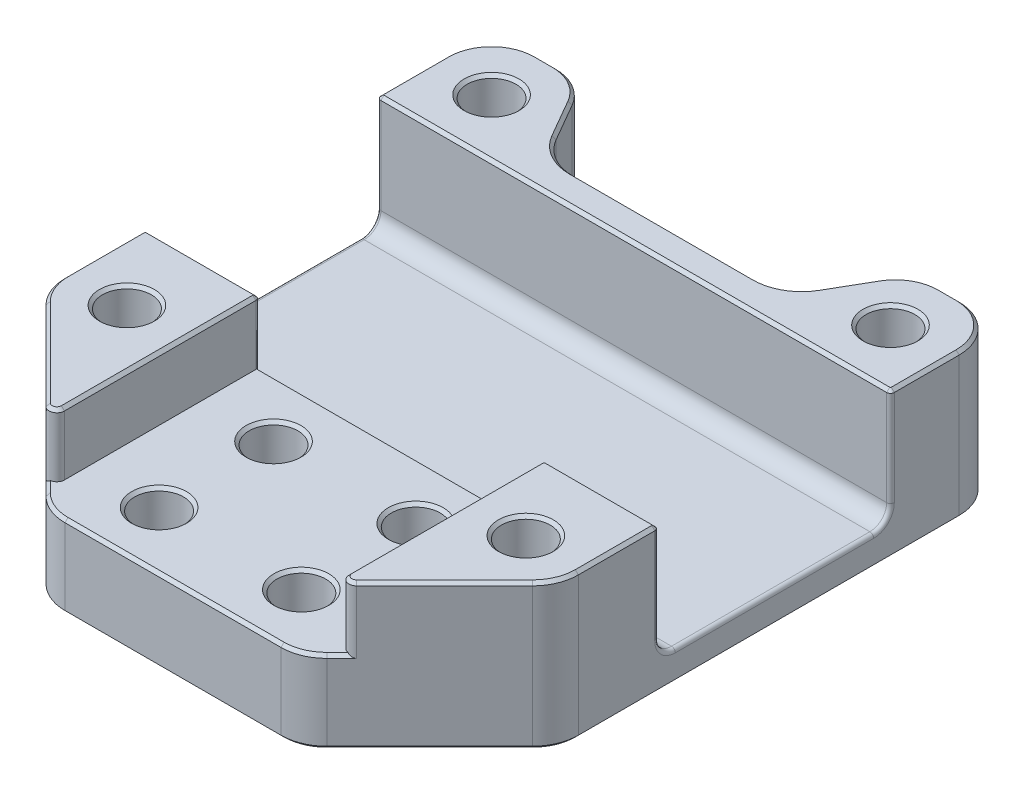
from build123d import *

# Parameters (mm, degrees)
SKETCH1_W           = 16.6624
SKETCH1_H           = 37.2872
BOSS_EXTRUDE1_DEPTH = 100
BOSS_EXTRUDE2_DEPTH = 18.6436
SKETCH2_3_W         = 8.2312
SKETCH2_3_H         = 29.9
SKETCH2_3_H_2       = 0.1
BOSS_EXTRUDE3_DEPTH = 15
SKETCH3_R           = 3.2
CUT_EXTRUDE1_DEPTH  = 151.542823877
FILLET1_R           = 6
FILLET3_R           = 2.2
FILLET2_R           = 0.5
FILLET4_R           = 1
CHAMFER1_SIZE       = 0.4


with BuildPart() as part:
    # Sketch1 → Boss-Extrude1 (new, symmetric)
    with BuildSketch(Plane(origin=(0, 0, 0), x_dir=(0, 1, 0), z_dir=(0, 0, 1))):
        Rectangle(SKETCH1_W, SKETCH1_H)
    extrude(amount=BOSS_EXTRUDE1_DEPTH, both=True)


with BuildPart() as body_2:
    # Sketch2 → Boss-Extrude2 (new body)
    with BuildSketch(Plane.YZ.offset(18.6436)):
        Polygon((-8.3312, -100), (-8.3312, -70.1), (-19.1, -70.1), (-19.1, -145.5), (-0.1, -145.5), (-0.1, -130.5), (-15.2, -130.5), (-15.2, -100.1), (-8.3312, -100.1), align=None)
    extrude(amount=-BOSS_EXTRUDE2_DEPTH)

    # Sketch2<3> → Boss-Extrude3 (add)
    with BuildSketch(Plane.YZ.offset(18.6436)):
        Polygon((-8.3312, -100), (-8.3312, -70.1), (-19.1, -70.1), (-19.1, -145.5), (-0.1, -145.5), (-0.1, -130.5), (-15.2, -130.5), (-15.2, -100.1), (-8.3312, -100.1), align=None)
        with Locations((-4.2156, -85.05)):
            Rectangle(SKETCH2_3_W, SKETCH2_3_H)
        with Locations((-4.2156, -100.05)):
            Rectangle(SKETCH2_3_W, SKETCH2_3_H_2)
    extrude(amount=BOSS_EXTRUDE3_DEPTH)

    # Sketch3 → Cut-Extrude1 (cut, through all)
    with BuildSketch(Plane.XZ.offset(19.1)):
        Polygon((15.46262002, -134.5), (0, -134.5), (0, -145.5), (21.813472981, -145.5), align=None)
        with Locations(Location((26.1436, -138, 0), (0, 0, 270))):
            Circle(SKETCH3_R)
        with Locations(Location((26.1436, -90.206601718, 0), (0, 0, 270))):
            Circle(SKETCH3_R)
        Polygon((33.6436, -70.1), (18.6436, -70.1), (18.6436, -72.1), (33.6436, -87.1), align=None)
        Polygon((18.6436, -70.1), (16.6436, -70.1), (18.6436, -72.1), align=None)
        with Locations(Location((9.3218, -77.6, 0), (0, 0, 270))):
            Circle(SKETCH3_R)
        with Locations(Location((9.3218, -92.6, 0), (0, 0, 270))):
            Circle(SKETCH3_R)
    extrude(amount=-CUT_EXTRUDE1_DEPTH, mode=Mode.SUBTRACT)

    # Fillet1
    fillet1_edges = [body_2.edges().sort_by_distance(p)[0] for p in [
        (15.46262002, -9.6, -134.5),
        (21.813472981, -9.6, -145.5),
        (33.6436, -9.6, -145.5),
        (16.6436, -13.7156, -70.1),
        (33.6436, -9.6, -87.1),
    ]]
    fillet(fillet1_edges, radius=FILLET1_R)

    # Fillet3
    fillet3_edges = [body_2.edges().sort_by_distance(p)[0] for p in [
        (16.8218, -15.2, -130.5),
        (16.8218, -15.2, -100.1),
    ]]
    fillet(fillet3_edges, radius=FILLET3_R)

    # Fillet2
    fillet2_edges = [body_2.edges().sort_by_distance(p)[0] for p in [
        (33.6436, -6.55, -130.5),
        (33.6436, -15.2, -115.3),
        (33.6436, -14.555634919, -129.855634919),
        (33.6436, -14.555634919, -100.744365081),
        (33.6436, -6.55, -100.1),
        (18.6436, -4.2156, -100.1),
    ]]
    fillet(fillet2_edges, radius=FILLET2_R)

    # Fillet4
    fillet4_edges = [body_2.edges().sort_by_distance(p)[0] for p in [
        (18.6436, -4.2156, -72.1),
    ]]
    fillet(fillet4_edges, radius=FILLET4_R)

    # Chamfer1
    chamfer1_edges = [body_2.edges().sort_by_distance(p)[0] for p in [
        (26.1436, -0.1, -87.006601718),
        (26.1436, -19.1, -87.006601718),
        (26.1436, -0.1, -134.8),
        (26.1436, -19.1, -134.8),
        (9.3218, -8.3312, -89.4),
        (9.3218, -19.1, -89.4),
        (5.999259202, -19.1, -134.5),
        (5.999259202, -0.1, -134.5),
        (26.460587298, -0.1, -145.5),
        (26.460587298, -19.1, -145.5),
        (33.6436, -19.1, -114.542640687),
        (25.1436, -19.1, -78.6),
        (18.638046501, -19.1, -140),
        (16.45441922, -19.1, -70.556722805),
        (33.186877195, -19.1, -87.28918078),
        (22.277574596, -19.1, -144.696152423),
        (31.886240687, -19.1, -143.742640687),
        (18.638046501, -0.1, -140),
        (22.277574596, -0.1, -144.696152423),
        (31.886240687, -0.1, -143.742640687),
        (19.375833047, -8.3312, -72.832233047),
        (33.186877195, -0.1, -87.28918078),
        (16.45441922, -8.3312, -70.556722805),
        (14.998518405, -19.1, -135.303847577),
        (14.998518405, -0.1, -135.303847577),
        (33.6436, -0.1, -135.25),
        (33.6436, -0.1, -94.592640687),
        (33.497153391, -0.1, -130.646446609),
        (18.6436, -0.1, -87.057106781),
        (26.1436, -0.1, -100.1),
        (33.497153391, -0.1, -99.953553391),
        (18.790046609, -0.1, -99.953553391),
        (26.118473734, -0.1, -79.574873734),
        (19.260916568, -0.1, -73.59033403),
        (7.079159313, -19.1, -70.1),
        (16.5718, -0.1, -130.5),
        (9.5718, -8.3312, -100.1),
        (7.079159313, -8.3312, -70.1),
        (9.3218, -8.3312, -74.4),
        (9.3218, -19.1, -74.4),
    ]]
    chamfer(chamfer1_edges, length=CHAMFER1_SIZE)

    # Mirror1: body 2 across plane


with BuildPart() as body_2_1:
    add(body_2.part)
    add(body_2.part.mirror(Plane(origin=(0, 0, 0), x_dir=(0, 0, 1), z_dir=(1, 0, 0))))


solid = body_2_1.part
